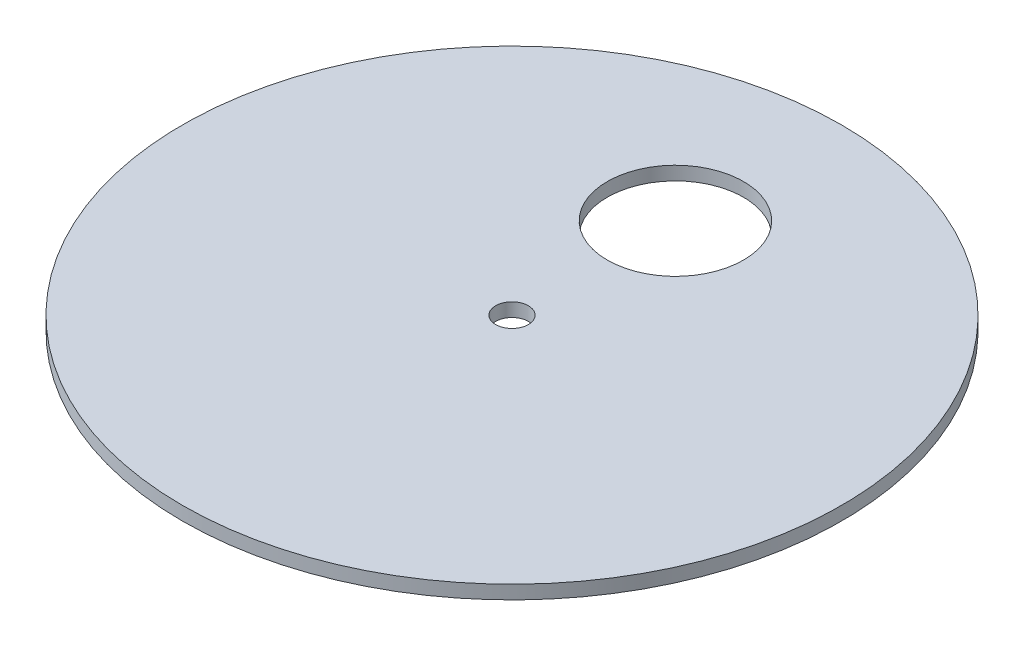
from build123d import *

# Parameters (mm, degrees)
SKETCH1_R           = 121
SKETCH1_R_2         = 6
SKETCH1_R_3         = 25
BOSS_EXTRUDE1_DEPTH = 5


with BuildPart() as part:
    # Sketch1 → Boss-Extrude1 (new body)
    with BuildSketch(Plane(origin=(0, 0, 0), x_dir=(1, 0, 0), z_dir=(0, 1, 0))):
        with Locations(Location((0, 0, 0), (0, 0, 270))):
            Circle(SKETCH1_R)
        with Locations(Location((0, 0, 0), (0, 0, 270))):
            Circle(SKETCH1_R_2, mode=Mode.SUBTRACT)
        with Locations(Location((0, 60, 0), (0, 0, 270))):
            Circle(SKETCH1_R_3, mode=Mode.SUBTRACT)
    extrude(amount=BOSS_EXTRUDE1_DEPTH)


solid = part.part
